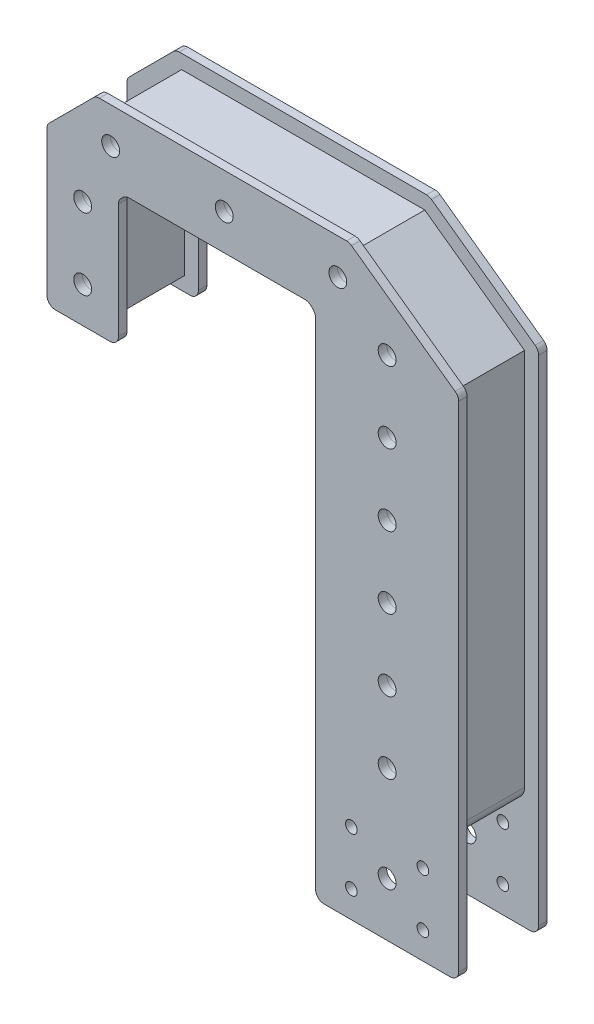
from build123d import *

# Parameters (mm, degrees)
SKETCH2_R           = 3.175
SKETCH2_R_2         = 2.07
BOSS_EXTRUDE1_DEPTH = 1.5
SKETCH3_R           = 3.175
BOSS_EXTRUDE2_DEPTH = 25.4
FILLET2_R           = 5
BOSS_EXTRUDE3_START = 26.9
SKETCH2_3_R         = 3.175
SKETCH2_3_R_2       = 2.07
BOSS_EXTRUDE3_DEPTH = 3
FILLET3_R           = 3
FILLET4_R           = 3


with BuildPart() as part:
    # Sketch2 → Boss-Extrude1 (new, symmetric)
    with BuildSketch(Plane.XY):
        Polygon((-25.4, 90), (-25.4, -90), (25.4, -90), (25.4, 90), (-13.421024484, 117.9), (-103.421024484, 117.9), (-120.8, 100.521024484), (-120.8, 45), (-95.4, 45), (-95.4, 90), (-92.9, 92.5), (-27.9, 92.5), align=None)
        with Locations((-108.1, 57.7)):
            Circle(SKETCH2_R, mode=Mode.SUBTRACT)
        with Locations((-108.1, 83.1)):
            Circle(SKETCH2_R, mode=Mode.SUBTRACT)
        with Locations((0, 90)):
            Circle(SKETCH2_R, mode=Mode.SUBTRACT)
        with Locations((0, 64.6)):
            Circle(SKETCH2_R, mode=Mode.SUBTRACT)
        with Locations((0, 39.2)):
            Circle(SKETCH2_R, mode=Mode.SUBTRACT)
        with Locations((0, 13.8)):
            Circle(SKETCH2_R, mode=Mode.SUBTRACT)
        with Locations((0, -11.6)):
            Circle(SKETCH2_R, mode=Mode.SUBTRACT)
        with Locations((0, -37)):
            Circle(SKETCH2_R, mode=Mode.SUBTRACT)
        with Locations((-57.835898506, 105.2)):
            Circle(SKETCH2_R, mode=Mode.SUBTRACT)
        with Locations((-98.160512242, 105.2)):
            Circle(SKETCH2_R, mode=Mode.SUBTRACT)
        with Locations((-17.51128477, 105.2)):
            Circle(SKETCH2_R, mode=Mode.SUBTRACT)
        with Locations((0, -70.95)):
            Circle(SKETCH2_R, mode=Mode.SUBTRACT)
        with Locations((-12.7, -61.425)):
            Circle(SKETCH2_R_2, mode=Mode.SUBTRACT)
        with Locations((12.7, -61.425)):
            Circle(SKETCH2_R_2, mode=Mode.SUBTRACT)
        with Locations((12.7, -80.475)):
            Circle(SKETCH2_R_2, mode=Mode.SUBTRACT)
        with Locations((-12.7, -80.475)):
            Circle(SKETCH2_R_2, mode=Mode.SUBTRACT)
    extrude(amount=BOSS_EXTRUDE1_DEPTH, both=True)

    # Fillet4
    fillet4_edges = [part.edges().sort_by_distance(p)[0] for p in [
        (-120.8, 100.521024484, 0),
        (-103.421024484, 117.9, 0),
        (-13.421024484, 117.9, 0),
        (25.4, 90, 0),
        (25.4, -90, 0),
        (-25.4, -90, 0),
        (-25.4, 90, 0),
        (-27.9, 92.5, 0),
        (-92.9, 92.5, 0),
        (-95.4, 90, 0),
        (-95.4, 45, 0),
        (-120.8, 45, 0),
    ]]
    fillet(fillet4_edges, radius=FILLET4_R)


with BuildPart() as body_2:
    # Sketch3 → Boss-Extrude2 (new body)
    with BuildSketch(Plane.XY.offset(1.5)):
        Polygon((-20.4, -51.9), (20.4, -51.9), (20.4, 87.436091053), (-15.031363179, 112.9), (-101.349956672, 112.9), (-115.8, 98.449956672), (-115.8, 50), (-100.4, 50), (-100.4, 92.071067812), (-94.971067812, 97.5), (-25.828932188, 97.5), (-20.4, 92.071067812), align=None)
        with Locations((0, -37)):
            Circle(SKETCH3_R, mode=Mode.SUBTRACT)
        with Locations((0, -11.6)):
            Circle(SKETCH3_R, mode=Mode.SUBTRACT)
        with Locations((0, 13.8)):
            Circle(SKETCH3_R, mode=Mode.SUBTRACT)
        with Locations((-108.1, 57.7)):
            Circle(SKETCH3_R, mode=Mode.SUBTRACT)
        with Locations((-108.1, 83.1)):
            Circle(SKETCH3_R, mode=Mode.SUBTRACT)
        with Locations((-98.160512242, 105.2)):
            Circle(SKETCH3_R, mode=Mode.SUBTRACT)
        with Locations((-57.835898506, 105.2)):
            Circle(SKETCH3_R, mode=Mode.SUBTRACT)
        with Locations((0, 39.2)):
            Circle(SKETCH3_R, mode=Mode.SUBTRACT)
        with Locations((0, 64.6)):
            Circle(SKETCH3_R, mode=Mode.SUBTRACT)
        with Locations((-17.51128477, 105.2)):
            Circle(SKETCH3_R, mode=Mode.SUBTRACT)
        with Locations((0, 90)):
            Circle(SKETCH3_R, mode=Mode.SUBTRACT)
    extrude(amount=BOSS_EXTRUDE2_DEPTH)

    # Fillet2
    fillet2_edges = [body_2.edges().sort_by_distance(p)[0] for p in [
        (20.4, -51.9, 14.2),
        (-20.4, -51.9, 14.2),
    ]]
    fillet(fillet2_edges, radius=FILLET2_R)


with BuildPart() as body_3:
    # Sketch2<3> → Boss-Extrude3 (new body)
    with BuildSketch(Plane.XY.offset(BOSS_EXTRUDE3_START)):
        Polygon((-25.4, 90), (-25.4, -90), (25.4, -90), (25.4, 90), (-13.421024484, 117.9), (-103.421024484, 117.9), (-120.8, 100.521024484), (-120.8, 45), (-95.4, 45), (-95.4, 90), (-92.9, 92.5), (-27.9, 92.5), align=None)
        with Locations((-108.1, 57.7)):
            Circle(SKETCH2_3_R, mode=Mode.SUBTRACT)
        with Locations((-108.1, 83.1)):
            Circle(SKETCH2_3_R, mode=Mode.SUBTRACT)
        with Locations((0, 90)):
            Circle(SKETCH2_3_R, mode=Mode.SUBTRACT)
        with Locations((0, 64.6)):
            Circle(SKETCH2_3_R, mode=Mode.SUBTRACT)
        with Locations((0, 39.2)):
            Circle(SKETCH2_3_R, mode=Mode.SUBTRACT)
        with Locations((0, 13.8)):
            Circle(SKETCH2_3_R, mode=Mode.SUBTRACT)
        with Locations((0, -11.6)):
            Circle(SKETCH2_3_R, mode=Mode.SUBTRACT)
        with Locations((0, -37)):
            Circle(SKETCH2_3_R, mode=Mode.SUBTRACT)
        with Locations((-57.835898506, 105.2)):
            Circle(SKETCH2_3_R, mode=Mode.SUBTRACT)
        with Locations((-98.160512242, 105.2)):
            Circle(SKETCH2_3_R, mode=Mode.SUBTRACT)
        with Locations((-17.51128477, 105.2)):
            Circle(SKETCH2_3_R, mode=Mode.SUBTRACT)
        with Locations((0, -70.95)):
            Circle(SKETCH2_3_R, mode=Mode.SUBTRACT)
        with Locations((-12.7, -61.425)):
            Circle(SKETCH2_3_R_2, mode=Mode.SUBTRACT)
        with Locations((12.7, -61.425)):
            Circle(SKETCH2_3_R_2, mode=Mode.SUBTRACT)
        with Locations((12.7, -80.475)):
            Circle(SKETCH2_3_R_2, mode=Mode.SUBTRACT)
        with Locations((-12.7, -80.475)):
            Circle(SKETCH2_3_R_2, mode=Mode.SUBTRACT)
    extrude(amount=BOSS_EXTRUDE3_DEPTH)

    # Fillet3
    fillet3_edges = [body_3.edges().sort_by_distance(p)[0] for p in [
        (-27.9, 92.5, 28.4),
        (-92.9, 92.5, 28.4),
        (-95.4, 90, 28.4),
        (-95.4, 45, 28.4),
        (-120.8, 45, 28.4),
        (-120.8, 100.521024484, 28.4),
        (-103.421024484, 117.9, 28.4),
        (-13.421024484, 117.9, 28.4),
        (25.4, 90, 28.4),
        (25.4, -90, 28.4),
        (-25.4, -90, 28.4),
        (-25.4, 90, 28.4),
    ]]
    fillet(fillet3_edges, radius=FILLET3_R)


solid = Compound([part.part, body_2.part, body_3.part])
